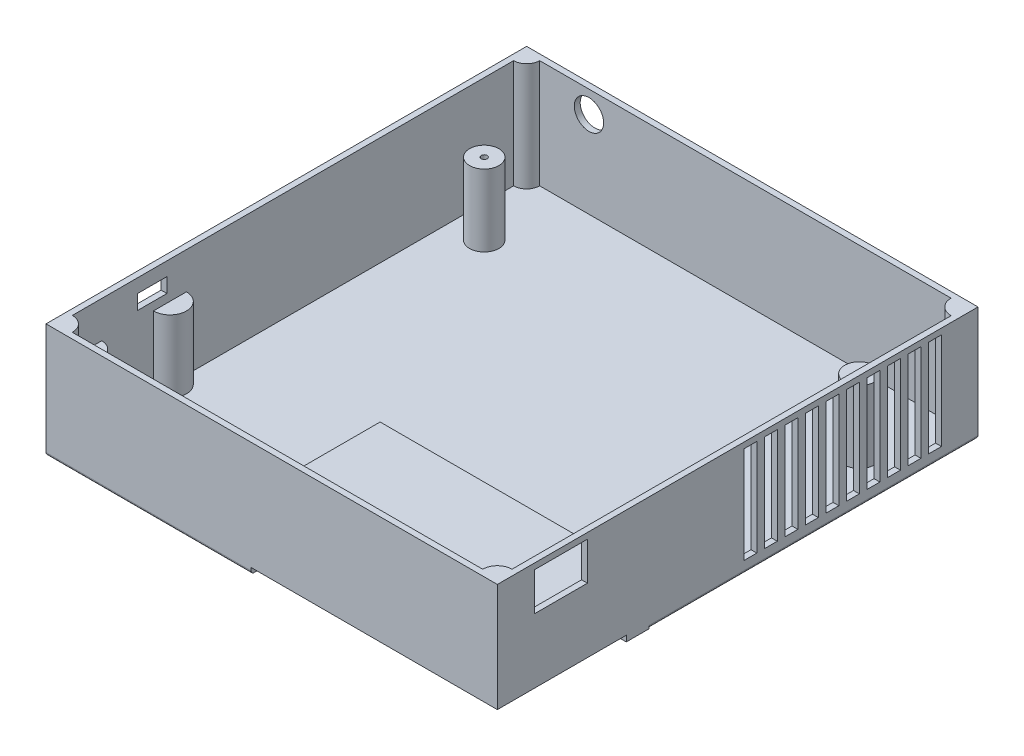
from build123d import *

# Parameters (mm, degrees)
SKETCH1_W               = 154
SKETCH1_H               = 164
BOSS_EXTRUDE1_DEPTH     = 39
FILLET2_R               = 1
SKETCH2_R               = 5
SKETCH2_R_2             = 1
CUT_EXTRUDE1_DEPTH      = 37
CUT_EXTRUDE2_DEPTH      = 178.004271116
CUT_EXTRUDE2_DEPTH_BACK = 12.5
SKETCH3_R               = 5
SKETCH4_W               = 76
SKETCH4_H               = 41
CUT_EXTRUDE3_DEPTH      = 20
SKETCH5_W               = 80
SKETCH5_H               = 2
BOSS_EXTRUDE2_DEPTH     = 18
SKETCH7_W               = 85
SKETCH7_H               = 45
BOSS_EXTRUDE3_DEPTH     = 2
SKETCH8_W               = 18
SKETCH8_H               = 13
CUT_EXTRUDE4_DEPTH      = 3
SKETCH10_W              = 4
SKETCH10_H              = 51.783631986
BOSS_EXTRUDE4_DEPTH     = 20
SKETCH11_W              = 84.004327952
SKETCH11_H              = 44
CUT_EXTRUDE8_DEPTH      = 2
SKETCH12_W              = 4.408390859
SKETCH12_H              = 33
CUT_EXTRUDE9_DEPTH      = 3
SKETCH13_R              = 5
CUT_EXTRUDE10_DEPTH     = 10
SKETCH14_W              = 10
SKETCH14_H              = 5
CUT_EXTRUDE11_DEPTH     = 10
SKETCH15_R              = 1
CUT_EXTRUDE12_DEPTH     = 10


with BuildPart() as part:
    # Sketch1 → Boss-Extrude1 (new body)
    with BuildSketch(Plane(origin=(0, 0, 0), x_dir=(1, 0, 0), z_dir=(0, 1, 0))):
        with Locations((-25.679775281, -56.803370787)):
            Rectangle(SKETCH1_W, SKETCH1_H)
    extrude(amount=BOSS_EXTRUDE1_DEPTH)

    # Fillet2
    fillet2_edges = [part.edges().sort_by_distance(p)[0] for p in [
        (-25.679775281, 0, -25.196629213),
        (51.320224719, 0, 56.803370787),
        (-25.679775281, 0, 138.803370787),
        (-102.679775281, 0, 56.803370787),
    ]]
    fillet(fillet2_edges, radius=FILLET2_R)

    # Sketch2 → Cut-Extrude1 (cut)
    # profile 1 of 3: a face of its own
    with BuildSketch(Plane(origin=(0, 39, 0), x_dir=(1, 0, 0), z_dir=(0, 1, 0))):
        with BuildLine():
            Line((44.132250696, 23.196629213), (-96.23424538, 23.196629213))
            ThreePointArc((-96.23424538, 23.196629213), (-97.536310942, 20.053164875), (-100.679775281, 18.751099313))
            Line((-100.679775281, 18.751099313), (-100.679775281, -92.88384898))
            ThreePointArc((-100.679775281, -92.88384898), (-95.035253474, -98.528370787), (-100.679775281, -104.172892593))
            Line((-100.679775281, -104.172892593), (-100.679775281, -121.803370787))
            ThreePointArc((-100.679775281, -121.803370787), (-95.679775281, -126.803370787), (-100.679775281, -131.803370787))
            ThreePointArc((-100.679775281, -131.803370787), (-97.144241375, -133.267836881), (-95.679775281, -136.803370787))
            Line((-95.679775281, -136.803370787), (44.320224719, -136.803370787))
            ThreePointArc((44.320224719, -136.803370787), (45.784690813, -133.267836881), (49.320224719, -131.803370787))
            Line((49.320224719, -131.803370787), (49.320224719, 18.00865519))
            ThreePointArc((49.320224719, 18.00865519), (45.651773106, 19.528177601), (44.132250696, 23.196629213))
        make_face()
        with Locations(Location((-89.679775281, -2.276961684, 0), (0, 0, 270))):
            Circle(SKETCH2_R, mode=Mode.SUBTRACT)
        with Locations(Location((38.320224719, -2.276961684, 0), (0, 0, 270))):
            Circle(SKETCH2_R, mode=Mode.SUBTRACT)
    # profile 2 of 3: a face of its own
    with BuildSketch(Plane(origin=(0, 39, 0), x_dir=(1, 0, 0), z_dir=(0, 1, 0))):
        with Locations(Location((-89.679775281, -2.276961684, 0), (0, 0, 270))):
            Circle(SKETCH2_R_2)
    # profile 3 of 3: a face of its own
    with BuildSketch(Plane(origin=(0, 39, 0), x_dir=(1, 0, 0), z_dir=(0, 1, 0))):
        with Locations(Location((38.320224719, -2.276961684, 0), (0, 0, 270))):
            Circle(SKETCH2_R_2)
    extrude(amount=-CUT_EXTRUDE1_DEPTH, mode=Mode.SUBTRACT)

    # Sketch3 → Cut-Extrude2 (cut, two sides: drawn at the far end of the back side and taken through both)
    with BuildSketch(Plane(origin=(0, 39, 0), x_dir=(1, 0, 0), z_dir=(0, 1, 0)).offset(-CUT_EXTRUDE2_DEPTH_BACK)):
        with Locations(Location((-89.679775281, -2.276961684, 0), (0, 0, 270))):
            Circle(SKETCH3_R)
        with Locations(Location((38.320224719, -2.276961684, 0), (0, 0, 270))):
            Circle(SKETCH3_R)
        with BuildLine():
            Line((-100.679775281, -92.528370787), (-100.679775281, -104.528370787))
            ThreePointArc((-100.679775281, -104.528370787), (-94.679775281, -98.528370787), (-100.679775281, -92.528370787))
        make_face()
        with BuildLine():
            Line((-100.679775281, -121.803370787), (-100.679775281, -131.803370787))
            ThreePointArc((-100.679775281, -131.803370787), (-95.679775281, -126.803370787), (-100.679775281, -121.803370787))
        make_face()
    extrude(amount=CUT_EXTRUDE2_DEPTH + CUT_EXTRUDE2_DEPTH_BACK, mode=Mode.SUBTRACT)

    # Sketch4 → Cut-Extrude3 (cut)
    with BuildSketch(Plane.XZ):
        with Locations((9.320224719, 116.303370787)):
            Rectangle(SKETCH4_W, SKETCH4_H)
    extrude(amount=-CUT_EXTRUDE3_DEPTH, mode=Mode.SUBTRACT)

    # Sketch5 → Boss-Extrude2 (add)
    with BuildSketch(Plane(origin=(0, 2, 0), x_dir=(1, 0, 0), z_dir=(0, 1, 0))):
        with Locations((11.320224719, -94.803370787)):
            Rectangle(SKETCH5_W, SKETCH5_H)
        Polygon((-28.679775281, -95.803370787), (-28.679775281, -93.803370787), (-33.679775281, -93.803370787), (-33.679775281, -136.803370787), (-28.679775281, -136.803370787), align=None)
    extrude(amount=BOSS_EXTRUDE2_DEPTH)

    # Sketch7 → Boss-Extrude3 (add)
    with BuildSketch(Plane(origin=(0, 20, 0), x_dir=(1, 0, 0), z_dir=(0, 1, 0))):
        with Locations((8.820224719, -116.303370787)):
            Rectangle(SKETCH7_W, SKETCH7_H)
    extrude(amount=BOSS_EXTRUDE3_DEPTH)

    # Sketch8 → Cut-Extrude4 (cut)
    with BuildSketch(Plane(origin=(51.320224719, 0, 0), x_dir=(0, 0, -1), z_dir=(1, 0, 0))):
        with Locations((-117.065973314, 30.5)):
            Rectangle(SKETCH8_W, SKETCH8_H)
    extrude(amount=-CUT_EXTRUDE4_DEPTH, mode=Mode.SUBTRACT)

    # Sketch10 → Boss-Extrude4 (add)
    with BuildSketch(Plane.XZ):
        with Locations((49.320224719, 112.911554794)):
            Rectangle(SKETCH10_W, SKETCH10_H)
    extrude(amount=-BOSS_EXTRUDE4_DEPTH)

    # Sketch11 → Cut-Extrude8 (cut)
    with BuildSketch(Plane.XZ):
        with Locations((9.318060743, 116.803370787)):
            Rectangle(SKETCH11_W, SKETCH11_H)
    extrude(amount=-CUT_EXTRUDE8_DEPTH, mode=Mode.SUBTRACT)

    # Sketch12 → Cut-Extrude9 (cut)
    with BuildSketch(Plane(origin=(51.320224719, 0, 0), x_dir=(0, 0, -1), z_dir=(1, 0, 0))):
        with Locations((-52.479756675, 20.5)):
            Rectangle(SKETCH12_W, SKETCH12_H)
        with Locations((-45.479756675, 20.5)):
            Rectangle(SKETCH12_W, SKETCH12_H)
        with Locations((-38.479756675, 20.5)):
            Rectangle(SKETCH12_W, SKETCH12_H)
        with Locations((-31.479756676, 20.5)):
            Rectangle(SKETCH12_W, SKETCH12_H)
        with Locations((-24.479756676, 20.5)):
            Rectangle(SKETCH12_W, SKETCH12_H)
        with Locations((-17.479756675, 20.5)):
            Rectangle(SKETCH12_W, SKETCH12_H)
        with Locations((-10.479756676, 20.5)):
            Rectangle(SKETCH12_W, SKETCH12_H)
        with Locations((-3.479756676, 20.5)):
            Rectangle(SKETCH12_W, SKETCH12_H)
        with Locations((3.520243324, 20.5)):
            Rectangle(SKETCH12_W, SKETCH12_H)
        with Locations((10.520243325, 20.5)):
            Rectangle(SKETCH12_W, SKETCH12_H)
    extrude(amount=-CUT_EXTRUDE9_DEPTH, mode=Mode.SUBTRACT)

    # Sketch13 → Cut-Extrude10 (cut)
    with BuildSketch(Plane(origin=(0, 0, -25.196629213), x_dir=(-1, 0, 0), z_dir=(0, 0, -1))):
        with Locations((79.41479284, 31.5)):
            Circle(SKETCH13_R)
    extrude(amount=-CUT_EXTRUDE10_DEPTH, mode=Mode.SUBTRACT)

    # Sketch14 → Cut-Extrude11 (cut)
    with BuildSketch(Plane.ZY.offset(102.679775281)):
        with Locations((104.532679505, 31.835930774)):
            Rectangle(SKETCH14_W, SKETCH14_H)
    extrude(amount=-CUT_EXTRUDE11_DEPTH, mode=Mode.SUBTRACT)

    # Sketch15 → Cut-Extrude12 (cut)
    with BuildSketch(Plane.XZ.offset(-2)):
        with Locations(Location((-30.684103233, 116.803370787, 0), (0, 0, 270))):
            Circle(SKETCH15_R)
        with Locations(Location((49.320224719, 116.803370787, 0), (0, 0, 270))):
            Circle(SKETCH15_R)
    extrude(amount=-CUT_EXTRUDE12_DEPTH, mode=Mode.SUBTRACT)


solid = part.part
